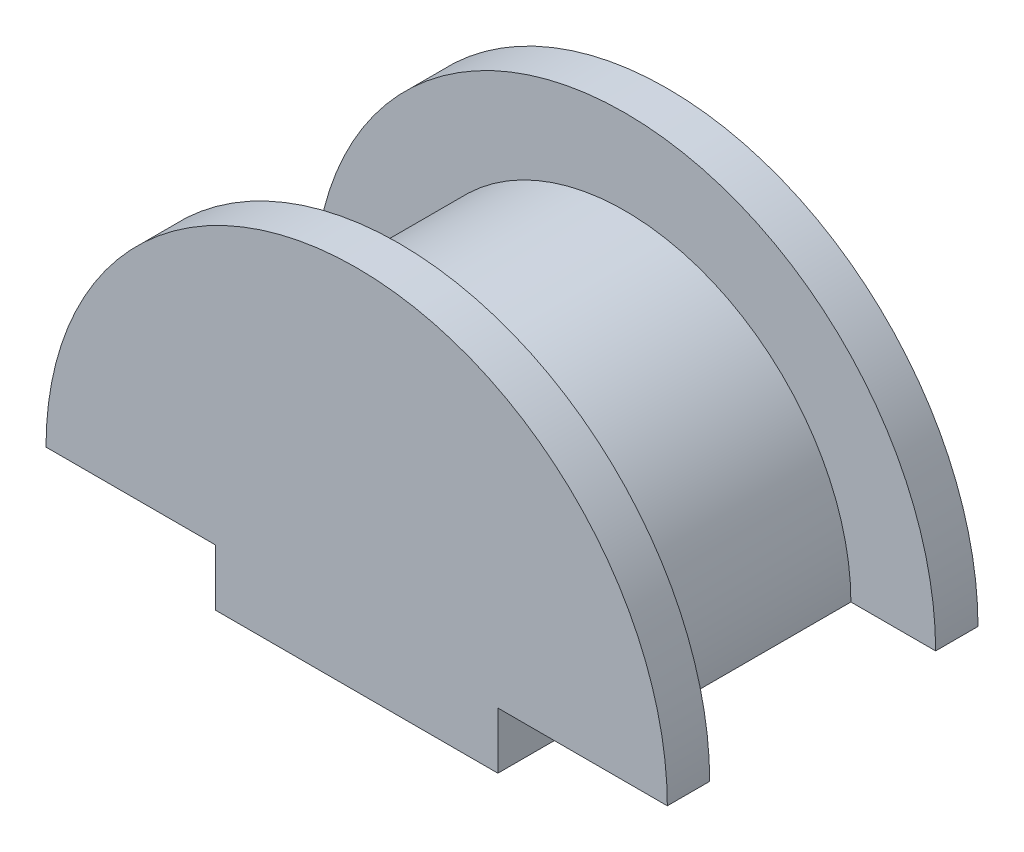
from build123d import *

# Parameters (mm, degrees)
CROQUIS1_W              = 5
CROQUIS1_H              = 2
SALIENTE_EXTRUIR1_DEPTH = 4
CROQUIS2_R              = 3
CORTAR_EXTRUIR1_DEPTH   = 6
SALIENTE_EXTRUIR2_START = 1.5
SALIENTE_EXTRUIR2_DEPTH = 1.5


with BuildPart() as part:
    # Croquis1 → Saliente-Extruir1 (new, symmetric)
    with BuildSketch(Plane.XY):
        with BuildLine():
            Line((5, 0), (8, 0))
            ThreePointArc((8, 0), (5.656854249, 5.656854249), (0, 8))
            Line((0, 8), (0, 0))
            Line((0, 0), (5, 0))
        make_face()
        with BuildLine():
            Line((0, 0), (0, 8))
            ThreePointArc((0, 8), (-5.656854249, 5.656854249), (-8, 0))
            Line((-8, 0), (-5, 0))
            Line((-5, 0), (0, 0))
        make_face()
        with BuildLine():
            Line((5, 0), (8, 0))
            ThreePointArc((8, 0), (5.656854249, 5.656854249), (0, 8))
            Line((0, 8), (0, 0))
            Line((0, 0), (5, 0))
        make_face()
        with BuildLine():
            Line((0, 0), (0, 8))
            ThreePointArc((0, 8), (-5.656854249, 5.656854249), (-8, 0))
            Line((-8, 0), (-5, 0))
            Line((-5, 0), (0, 0))
        make_face()
        with Locations((2.5, -1)):
            Rectangle(CROQUIS1_W, CROQUIS1_H)
        with Locations((-2.5, -1)):
            Rectangle(CROQUIS1_W, CROQUIS1_H)
    extrude(amount=SALIENTE_EXTRUIR1_DEPTH, both=True)

    # Croquis2 → Cortar-Extruir1 (cut)
    with BuildSketch(Plane.XZ.offset(2)):
        with Locations(Location((0, 0, 0), (0, 0, 270))):
            Circle(CROQUIS2_R)
    extrude(amount=-CORTAR_EXTRUIR1_DEPTH, mode=Mode.SUBTRACT)

    # Croquis3 → Saliente-Extruir2 (add)
    with BuildSketch(Plane.XY.offset(4).offset(SALIENTE_EXTRUIR2_START)):
        with BuildLine():
            Line((8, 0), (11, 0))
            ThreePointArc((11, 0), (0, 11), (-11, 0))
            Line((-11, 0), (-8, 0))
            ThreePointArc((-8, 0), (0, 8), (8, 0))
        make_face()
        with BuildLine():
            Line((-5, 0), (-5, -2))
            Line((-5, -2), (5, -2))
            Line((5, -2), (5, 0))
            Line((5, 0), (8, 0))
            ThreePointArc((8, 0), (0, 8), (-8, 0))
            Line((-8, 0), (-5, 0))
        make_face()
    saliente_extruir2 = extrude(amount=-SALIENTE_EXTRUIR2_DEPTH)

    # Simetría1: Saliente-Extruir2 across plane
    add(saliente_extruir2.mirror(Plane.XY))


solid = part.part
